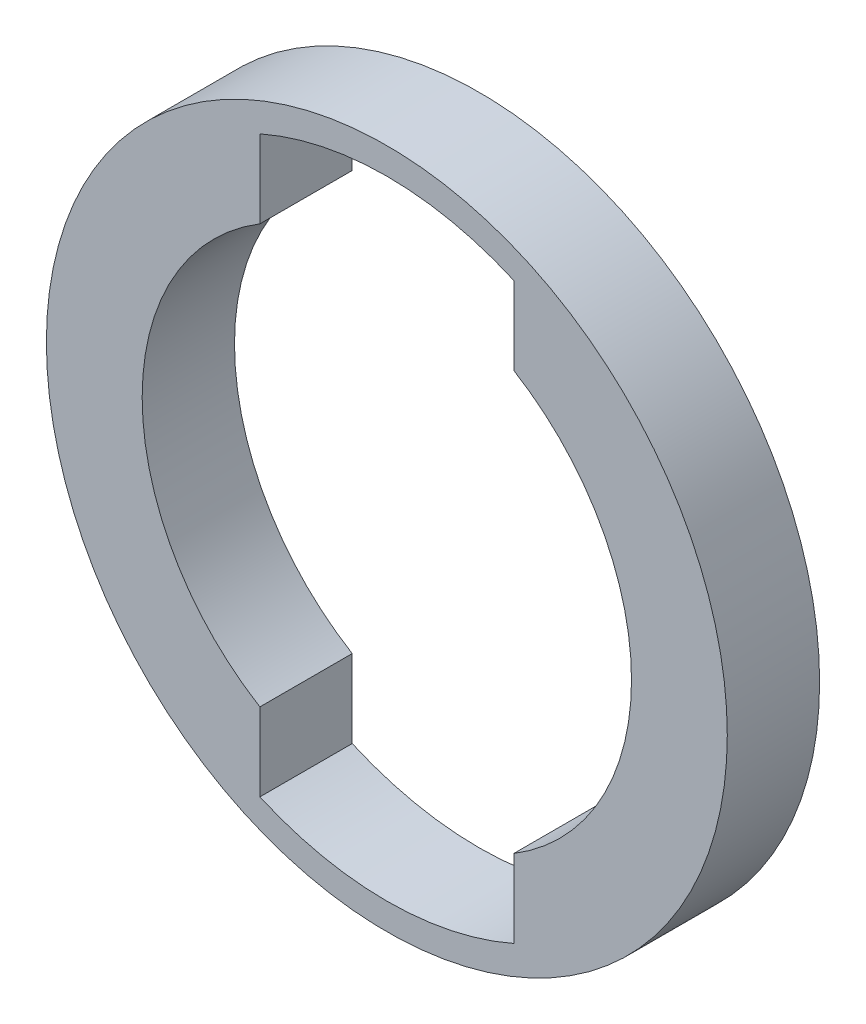
from build123d import *

# Parameters (mm, degrees)
SKETCH3_R           = 7.375
BOSS_EXTRUDE1_DEPTH = 2


with BuildPart() as part:
    # Sketch3 → Boss-Extrude1 (new body)
    with BuildSketch(Plane.XY):
        Circle(SKETCH3_R)
        with BuildLine():
            Line((-2.75, 6.219123732), (-2.75, 4.530728418))
            ThreePointArc((-2.75, 4.530728418), (-5.3, 0), (-2.75, -4.530728418))
            Line((-2.75, -4.530728418), (-2.75, -6.219123732))
            ThreePointArc((-2.75, -6.219123732), (0, -6.8), (2.75, -6.219123732))
            Line((2.75, -6.219123732), (2.75, -4.530728418))
            ThreePointArc((2.75, -4.530728418), (5.3, 0), (2.75, 4.530728418))
            Line((2.75, 4.530728418), (2.75, 6.219123732))
            ThreePointArc((2.75, 6.219123732), (0, 6.8), (-2.75, 6.219123732))
        make_face(mode=Mode.SUBTRACT)
    extrude(amount=-BOSS_EXTRUDE1_DEPTH)


solid = part.part
